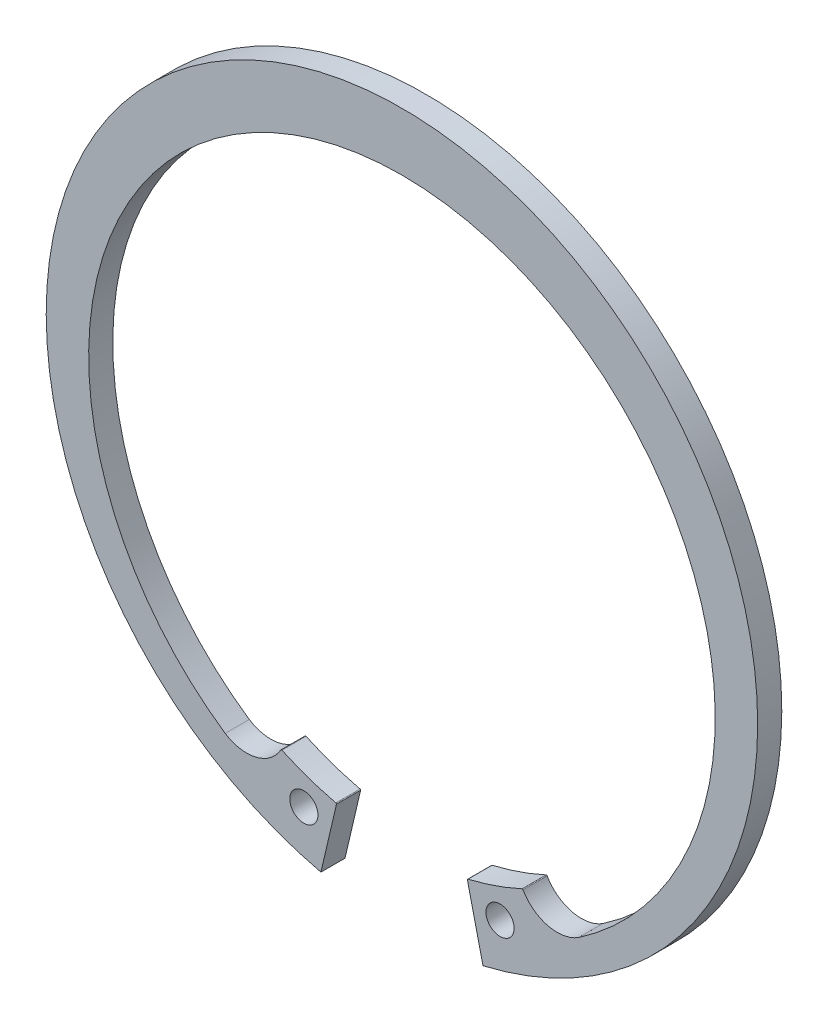
from build123d import *

# Parameters (mm, degrees)
BODYSKE_R    = 1.75
BODY_DEPTH   = 3
MODLUGSKE_R  = 1.75
MODLUG_DEPTH = 3


with BuildPart() as part:
    # BodySke → Body (new body)
    with BuildSketch(Plane.XY):
        with BuildLine():
            Line((10.081585159, -43.086240735), (8.868287827, -37.900903301))
            ThreePointArc((8.868287827, -37.900903301), (10.703270294, -34.041486241), (14.873364331, -34.975604235))
            ThreePointArc((14.873364331, -34.975604235), (16.90031341, -36.194693378), (19.234026397, -35.809356377))
            ThreePointArc((19.234026397, -35.809356377), (0, 37.05), (-19.234026397, -35.809356377))
            ThreePointArc((-19.234026397, -35.809356377), (-16.90031341, -36.194693378), (-14.873364331, -34.975604235))
            ThreePointArc((-14.873364331, -34.975604235), (-10.703270294, -34.041486241), (-8.868287827, -37.900903301))
            Line((-8.868287827, -37.900903301), (-10.081585159, -43.086240735))
            ThreePointArc((-10.081585159, -43.086240735), (0, 44.25), (10.081585159, -43.086240735))
        make_face()
        with Locations((12.203211545, -37.120577218)):
            Circle(BODYSKE_R, mode=Mode.SUBTRACT)
        with Locations((-12.203211545, -37.120577218)):
            Circle(BODYSKE_R, mode=Mode.SUBTRACT)
    extrude(amount=-BODY_DEPTH)

    # ModLugSke → ModLug (add, through all)
    # profile 1 of 2: a face of its own
    with BuildSketch(Plane.XY):
        with BuildLine():
            Line((10.081585159, -43.086240735), (8.144977614, -34.80965153))
            ThreePointArc((8.144977614, -34.80965153), (8.157312771, -34.734246339), (8.219292131, -34.689562362))
            ThreePointArc((8.219292131, -34.689562362), (11.633914265, -33.698286884), (14.932810143, -32.3718038))
            ThreePointArc((14.932810143, -32.3718038), (15.005023057, -32.367317402), (15.061361001, -32.412714194))
            ThreePointArc((15.061361001, -32.412714194), (18.162856033, -34.737008364), (21.984406764, -34.09097057))
            Line((21.984406764, -34.09097057), (23.981589909, -37.187979852))
            ThreePointArc((23.981589909, -37.187979852), (17.285032377, -40.734385422), (10.081585159, -43.086240735))
        make_face()
        with Locations((12.203211545, -37.120577218)):
            Circle(MODLUGSKE_R, mode=Mode.SUBTRACT)
    # profile 2 of 2: a face of its own
    with BuildSketch(Plane.XY):
        with BuildLine():
            Line((-10.081585159, -43.086240735), (-8.144977614, -34.80965153))
            ThreePointArc((-8.144977614, -34.80965153), (-8.157312771, -34.734246339), (-8.219292131, -34.689562362))
            ThreePointArc((-8.219292131, -34.689562362), (-11.633914265, -33.698286884), (-14.932810143, -32.3718038))
            ThreePointArc((-14.932810143, -32.3718038), (-15.005023057, -32.367317402), (-15.061361001, -32.412714194))
            ThreePointArc((-15.061361001, -32.412714194), (-18.162856033, -34.737008364), (-21.984406764, -34.09097057))
            Line((-21.984406764, -34.09097057), (-23.981589909, -37.187979852))
            ThreePointArc((-23.981589909, -37.187979852), (-17.285032377, -40.734385422), (-10.081585159, -43.086240735))
        make_face()
        with Locations((-12.203211545, -37.120577218)):
            Circle(MODLUGSKE_R, mode=Mode.SUBTRACT)
    extrude(amount=-MODLUG_DEPTH)


solid = part.part
